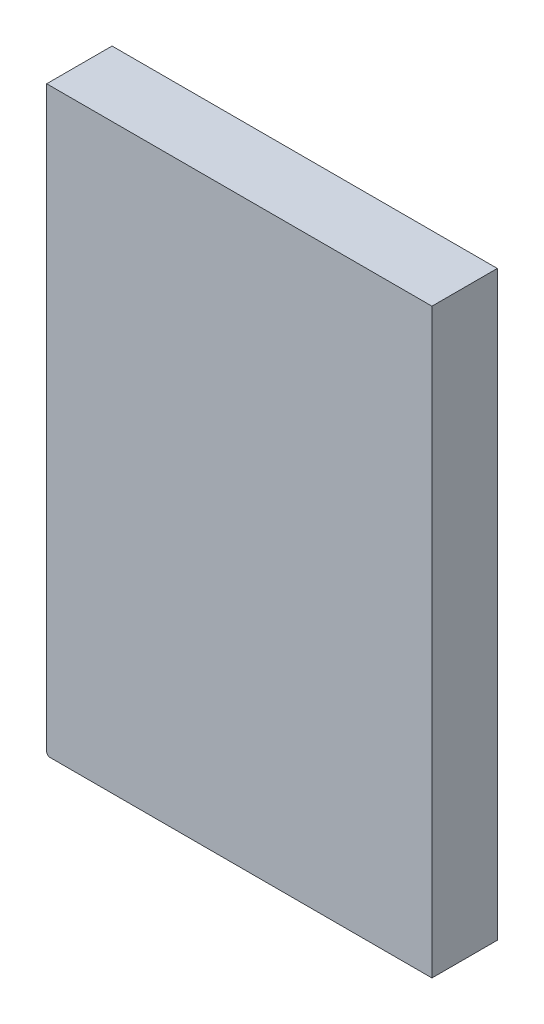
from build123d import *

# Parameters (mm, degrees)
SKETCH1_W           = 700
SKETCH1_H           = 900
BOSS_EXTRUDE1_DEPTH = 100
SKETCH2_W           = 102.863504397
SKETCH2_H           = 900
CUT_EXTRUDE1_DEPTH  = 1145.552314226
SKETCH3_W           = 597.136495603
SKETCH3_H           = 5
CUT_EXTRUDE2_DEPTH  = 1085.69903401
FILLET1_R           = 5
SKETCH4_W           = 597.136495603
SKETCH4_H           = 5
CUT_EXTRUDE3_DEPTH  = 1085.69903401
SKETCH5_W           = 7.806368853
SKETCH5_H           = 890
CUT_EXTRUDE4_DEPTH  = 1081.554021964


with BuildPart() as part:
    # Sketch1 → Boss-Extrude1 (new body)
    with BuildSketch(Plane.XY):
        with Locations((350, 450)):
            Rectangle(SKETCH1_W, SKETCH1_H)
    extrude(amount=BOSS_EXTRUDE1_DEPTH)

    # Sketch2 → Cut-Extrude1 (cut, through all)
    with BuildSketch(Plane.XY.offset(100)):
        with Locations((648.568247802, 450)):
            Rectangle(SKETCH2_W, SKETCH2_H)
    extrude(amount=-CUT_EXTRUDE1_DEPTH, mode=Mode.SUBTRACT)

    # Sketch3 → Cut-Extrude2 (cut, through all)
    with BuildSketch(Plane.XY.offset(100)):
        with Locations((298.568247802, 2.5)):
            Rectangle(SKETCH3_W, SKETCH3_H)
    extrude(amount=-CUT_EXTRUDE2_DEPTH, mode=Mode.SUBTRACT)

    # Fillet1
    fillet1_edges = [part.edges().sort_by_distance(p)[0] for p in [
        (597.136495603, 900, 50),
        (0, 5, 50),
        (597.136495603, 5, 50),
        (0, 900, 50),
    ]]
    fillet(fillet1_edges, radius=FILLET1_R)

    # Sketch4 → Cut-Extrude3 (cut, through all)
    with BuildSketch(Plane.XY.offset(100)):
        with Locations((298.568247802, 897.5)):
            Rectangle(SKETCH4_W, SKETCH4_H)
    extrude(amount=-CUT_EXTRUDE3_DEPTH, mode=Mode.SUBTRACT)

    # Sketch5 → Cut-Extrude4 (cut, through all)
    with BuildSketch(Plane.XY.offset(100)):
        with Locations((593.233311177, 450)):
            Rectangle(SKETCH5_W, SKETCH5_H)
    extrude(amount=-CUT_EXTRUDE4_DEPTH, mode=Mode.SUBTRACT)


solid = part.part
